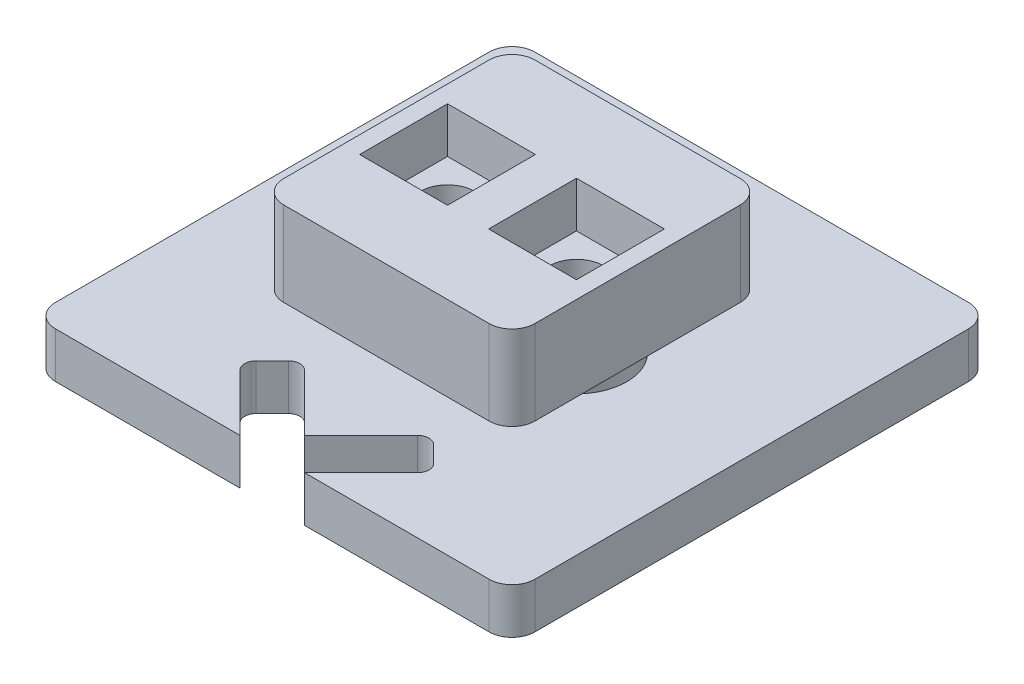
from build123d import *

# Parameters (mm, degrees)
SKETCH1_W           = 11
SKETCH1_H           = 11
BOSS_EXTRUDE1_DEPTH = 3.7
FILLET1_R           = 1
SKETCH2_W           = 3.85
SKETCH2_H           = 3.85
CUT_EXTRUDE1_DEPTH  = 2
SKETCH4_R           = 2.2
BOSS_EXTRUDE2_DEPTH = 3
BOSS_EXTRUDE3_DEPTH = 2
SKETCH3_R           = 1.2
CUT_EXTRUDE2_DEPTH  = 17.290794947
CUT_EXTRUDE3_DEPTH  = 16.57530096


with BuildPart() as part:
    # Sketch1 → Boss-Extrude1 (new body)
    with BuildSketch(Plane(origin=(0, 0, 0), x_dir=(1, 0, 0), z_dir=(0, 1, 0))):
        Rectangle(SKETCH1_W, SKETCH1_H)
    extrude(amount=BOSS_EXTRUDE1_DEPTH)

    # Fillet1
    fillet1_edges = [part.edges().sort_by_distance(p)[0] for p in [
        (5.5, 1.85, 5.5),
        (-5.5, 1.85, 5.5),
        (-5.5, 1.85, -5.5),
        (5.5, 1.85, -5.5),
    ]]
    fillet(fillet1_edges, radius=FILLET1_R)

    # Sketch2 → Cut-Extrude1 (cut)
    with BuildSketch(Plane(origin=(0, 3.7, 0), x_dir=(1, 0, 0), z_dir=(0, 1, 0))):
        with Locations((-2.825, 0)):
            Rectangle(SKETCH2_W, SKETCH2_H)
        with Locations((2.825, 0)):
            Rectangle(SKETCH2_W, SKETCH2_H)
    extrude(amount=-CUT_EXTRUDE1_DEPTH, mode=Mode.SUBTRACT)

    # Sketch4 → Boss-Extrude2 (add)
    with BuildSketch(Plane(origin=(0, 0, 0), x_dir=(-1, 0, 0), z_dir=(0, -1, 0))):
        with Locations(Location((2.825, 0, 0), (0, 0, 90))):
            Circle(SKETCH4_R)
        with Locations(Location((-2.825, 0, 0), (0, 0, 90))):
            Circle(SKETCH4_R)
    extrude(amount=BOSS_EXTRUDE2_DEPTH)

    # Sketch5 → Boss-Extrude3 (add)
    with BuildSketch(Plane(origin=(0, -3, 0), x_dir=(-1, 0, 0), z_dir=(0, -1, 0))):
        with BuildLine():
            Line((9.5, 10.5), (-9.5, 10.5))
            ThreePointArc((-9.5, 10.5), (-10.207106781, 10.207106781), (-10.5, 9.5))
            Line((-10.5, 9.5), (-10.5, -9.5))
            ThreePointArc((-10.5, -9.5), (-10.207106781, -10.207106781), (-9.5, -10.5))
            Line((-9.5, -10.5), (9.5, -10.5))
            ThreePointArc((9.5, -10.5), (10.207106781, -10.207106781), (10.5, -9.5))
            Line((10.5, -9.5), (10.5, 9.5))
            ThreePointArc((10.5, 9.5), (10.207106781, 10.207106781), (9.5, 10.5))
        make_face()
    extrude(amount=-BOSS_EXTRUDE3_DEPTH)

    # Sketch3 → Cut-Extrude2 (cut, through all)
    with BuildSketch(Plane(origin=(0, 3.7, 0), x_dir=(1, 0, 0), z_dir=(0, 1, 0))):
        with Locations(Location((-2.825, 0, 0), (0, 0, 270))):
            Circle(SKETCH3_R)
        with Locations(Location((2.825, 0, 0), (0, 0, 270))):
            Circle(SKETCH3_R)
    extrude(amount=-CUT_EXTRUDE2_DEPTH, mode=Mode.SUBTRACT)

    # Sketch7 → Cut-Extrude3 (cut, through all)
    with BuildSketch(Plane(origin=(0, -1, 0), x_dir=(1, 0, 0), z_dir=(0, 1, 0))):
        with BuildLine():
            Line((0, -9.085786438), (1.414213562, -10.5))
            Line((1.414213562, -10.5), (3.889087297, -8.025126266))
            ThreePointArc((3.889087297, -8.025126266), (4.035533906, -7.671572875), (3.889087297, -7.318019485))
            Line((3.889087297, -7.318019485), (3.181980515, -6.610912703))
            ThreePointArc((3.181980515, -6.610912703), (2.828427125, -6.464466094), (2.474873734, -6.610912703))
            Line((2.474873734, -6.610912703), (0, -9.085786438))
        make_face()
        with BuildLine():
            Line((-3.889087297, -8.025126266), (-1.414213562, -10.5))
            Line((-1.414213562, -10.5), (0, -9.085786438))
            Line((0, -9.085786438), (-2.474873734, -6.610912703))
            ThreePointArc((-2.474873734, -6.610912703), (-2.828427125, -6.464466094), (-3.181980515, -6.610912703))
            Line((-3.181980515, -6.610912703), (-3.889087297, -7.318019485))
            ThreePointArc((-3.889087297, -7.318019485), (-4.035533906, -7.671572875), (-3.889087297, -8.025126266))
        make_face()
        Polygon((-1.414213562, -10.5), (1.414213562, -10.5), (0, -9.085786438), align=None)
    extrude(amount=-CUT_EXTRUDE3_DEPTH, mode=Mode.SUBTRACT)


solid = part.part
